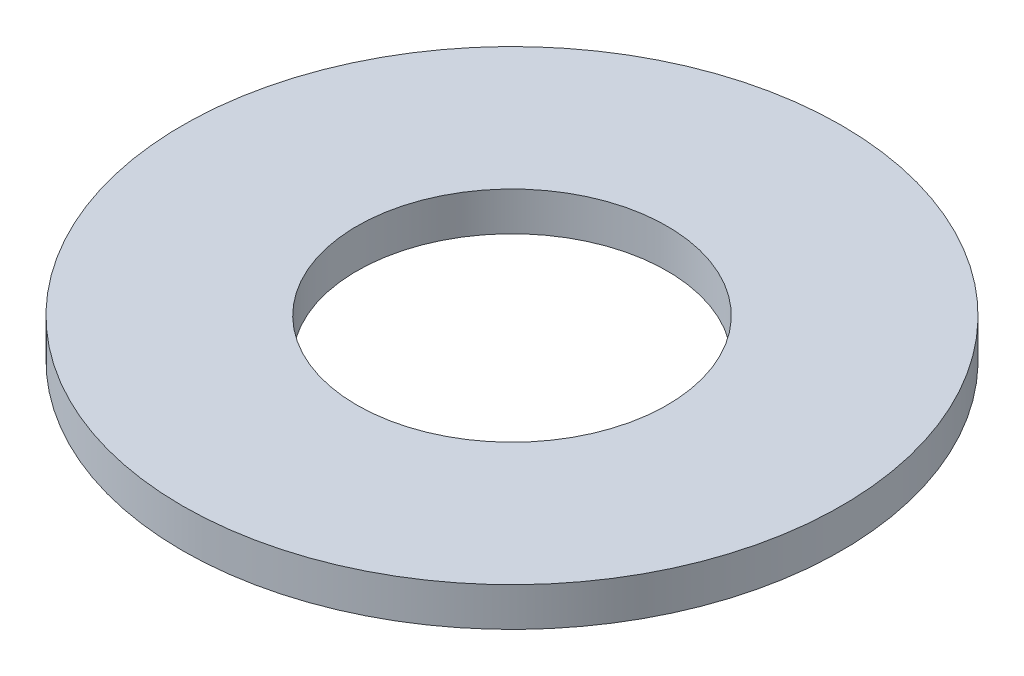
from build123d import *

# Parameters (mm, degrees)
SKETCH1_R           = 17
SKETCH1_R_2         = 8
BOSS_EXTRUDE1_DEPTH = 2


with BuildPart() as part:
    # Sketch1 → Boss-Extrude1 (new body)
    with BuildSketch(Plane(origin=(0, 0, 0), x_dir=(1, 0, 0), z_dir=(0, 1, 0))):
        with Locations(Location((0, 0, 0), (0, 0, 270))):
            Circle(SKETCH1_R)
        with Locations(Location((0, 0, 0), (0, 0, 270))):
            Circle(SKETCH1_R_2, mode=Mode.SUBTRACT)
    extrude(amount=BOSS_EXTRUDE1_DEPTH)


solid = part.part
